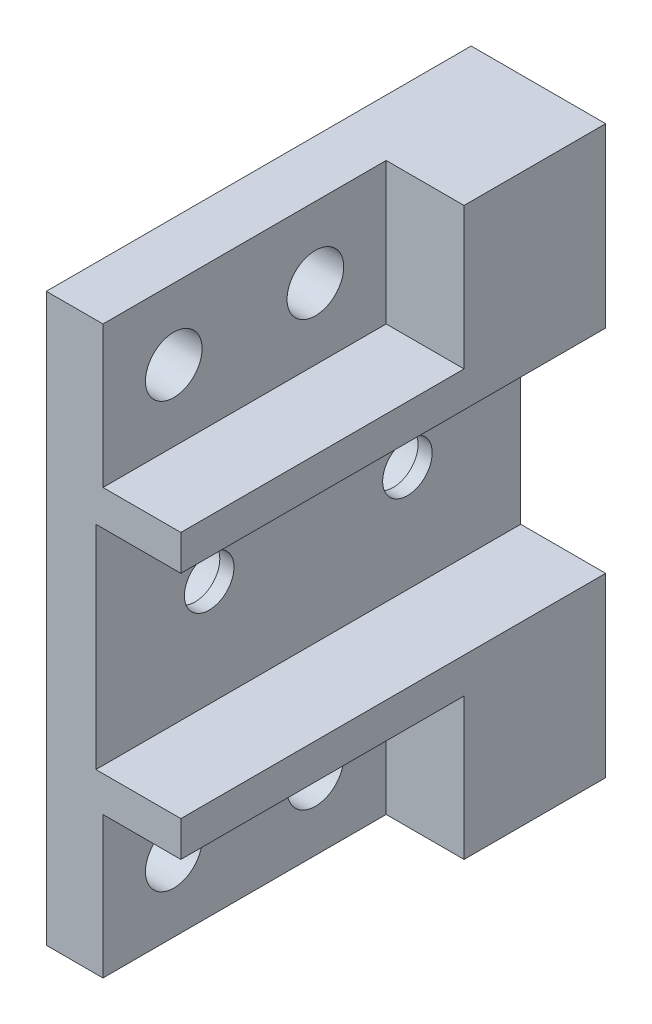
from build123d import *

# Parameters (mm, degrees)
BOSS_EXTRU_1_DEPTH      = 30
ESQUISSE2_R             = 1.75
ENL_V_MAT_EXTRU_1_DEPTH = 37.551333765
ESQUISSE3_R             = 3
ENL_V_MAT_EXTRU_2_DEPTH = 2.5
ESQUISSE4_W             = 30
ESQUISSE4_H             = 10
ESQUISSE4_R             = 2
BOSS_EXTRU_2_DEPTH      = 4
ESQUISSE5_W             = 9.5
ESQUISSE5_H             = 12.5
ESQUISSE5_H_2           = 10
BOSS_EXTRU_3_DEPTH      = 10
ESQUISSE6_R             = 3
ENL_V_MAT_EXTRU_3_DEPTH = 8


with BuildPart() as part:
    # Esquisse1 → Boss.-Extru.1 (new body)
    with BuildSketch(Plane.XY):
        Polygon((9.5, 20), (9.5, 17.5), (3.5, 17.5), (3.5, 2.5), (9.5, 2.5), (9.5, 0), (0, 0), (0, 20), align=None)
    extrude(amount=BOSS_EXTRU_1_DEPTH)

    # Esquisse2 → Enlèv. mat.-Extru.1 (cut, through all)
    with BuildSketch(Plane(origin=(3.5, 0, 0), x_dir=(0, 0, -1), z_dir=(1, 0, 0))):
        with Locations((-22, 10)):
            Circle(ESQUISSE2_R)
        with Locations((-8, 10)):
            Circle(ESQUISSE2_R)
    extrude(amount=-ENL_V_MAT_EXTRU_1_DEPTH, mode=Mode.SUBTRACT)

    # Esquisse3 → Enlèv. mat.-Extru.2 (cut)
    with BuildSketch(Plane.ZY):
        with Locations((8, 10)):
            Circle(ESQUISSE3_R)
        with Locations((22, 10)):
            Circle(ESQUISSE3_R)
    extrude(amount=-ENL_V_MAT_EXTRU_2_DEPTH, mode=Mode.SUBTRACT)

    # Esquisse4 → Boss.-Extru.2 (add)
    # profile 1 of 2: a face of its own
    with BuildSketch(Plane.ZY):
        with Locations((15, -5)):
            Rectangle(ESQUISSE4_W, ESQUISSE4_H)
        with Locations((15, -5)):
            Circle(ESQUISSE4_R, mode=Mode.SUBTRACT)
        with Locations((5, -5)):
            Circle(ESQUISSE4_R, mode=Mode.SUBTRACT)
        with Locations((25, -5)):
            Circle(ESQUISSE4_R, mode=Mode.SUBTRACT)
    # profile 2 of 2: a face of its own
    with BuildSketch(Plane.ZY):
        with Locations((15, 25)):
            Rectangle(ESQUISSE4_W, ESQUISSE4_H)
        with Locations((15, 25)):
            Circle(ESQUISSE4_R, mode=Mode.SUBTRACT)
        with Locations((5, 25)):
            Circle(ESQUISSE4_R, mode=Mode.SUBTRACT)
        with Locations((25, 25)):
            Circle(ESQUISSE4_R, mode=Mode.SUBTRACT)
    extrude(amount=-BOSS_EXTRU_2_DEPTH)

    # Esquisse5 → Boss.-Extru.3 (add)
    with BuildSketch(Plane(origin=(0, 0, 0), x_dir=(-1, 0, 0), z_dir=(0, 0, -1))):
        with Locations((-4.75, 23.75)):
            Rectangle(ESQUISSE5_W, ESQUISSE5_H)
        with Locations((-4.75, -5)):
            Rectangle(ESQUISSE5_W, ESQUISSE5_H_2)
    extrude(amount=-BOSS_EXTRU_3_DEPTH)

    # Esquisse6 → Enlèv. mat.-Extru.3 (cut)
    with BuildSketch(Plane(origin=(0, 0, 0), x_dir=(-1, 0, 0), z_dir=(0, 0, -1))):
        with Locations((-5, 25)):
            Circle(ESQUISSE6_R)
        with Locations((-5, -5)):
            Circle(ESQUISSE6_R)
    extrude(amount=-ENL_V_MAT_EXTRU_3_DEPTH, mode=Mode.SUBTRACT)


solid = part.part
